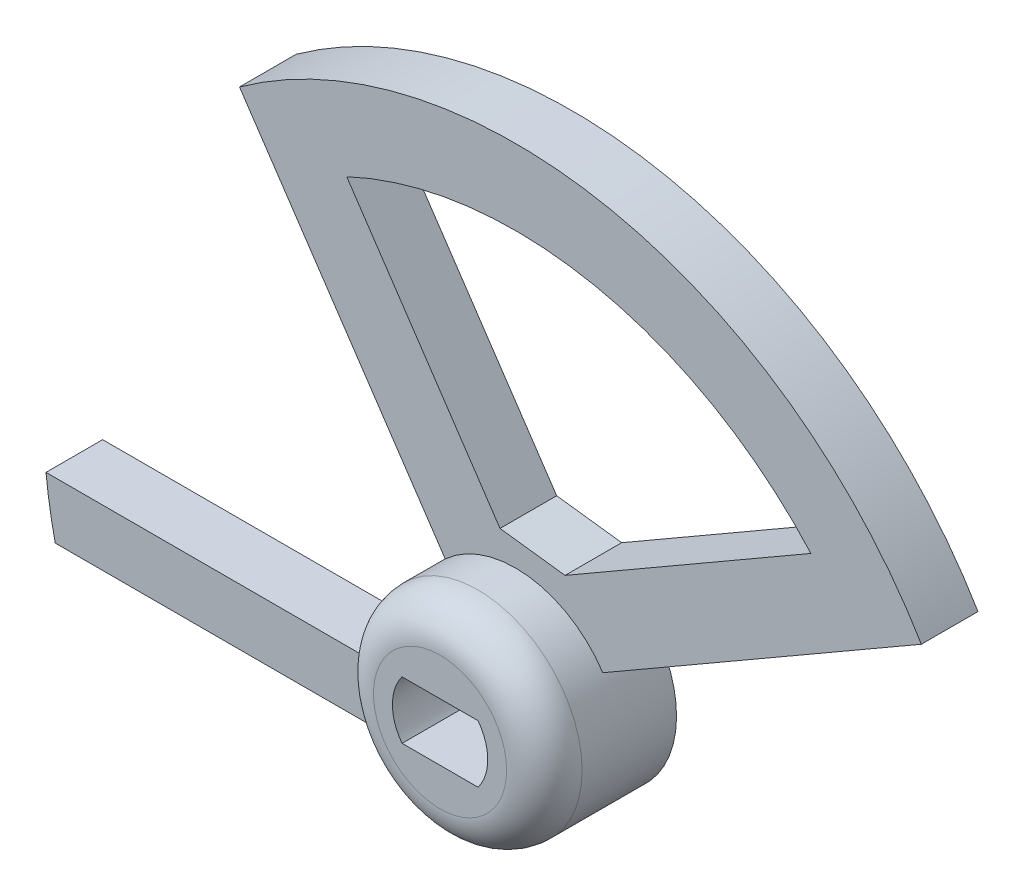
from build123d import *
from build123d.topology import SkipClean

# Parameters (mm, degrees)
BOSS_EXTRUDE2_DEPTH = 3
CUT_EXTRUDE1_DEPTH  = 3
BOSS_EXTRUDE3_DEPTH = 4
FILLET1_R           = 2


with BuildPart() as part:
    # Sketch1 → Boss-Extrude2 (new body)
    with BuildSketch(Plane.XY):
        with BuildLine():
            ThreePointArc((0, -5.525), (-2.878801834, -4.715731651), (-4.91426495, -2.525))
            Line((-4.91426495, -2.525), (-24.872160642, -2.525))
            ThreePointArc((-24.872160642, -2.525), (-24.672642191, -4.032459214), (-24.381845193, -5.525))
            Line((-24.381845193, -5.525), (0, -5.525))
        make_face()
        with BuildLine():
            ThreePointArc((0, -2.525), (1.123610253, -2.261222015), (2.01246118, -1.525))
            Line((2.01246118, -1.525), (-2.01246118, -1.525))
            ThreePointArc((-2.01246118, -1.525), (-1.123610253, -2.261222015), (0, -2.525))
        make_face()
        with BuildLine():
            ThreePointArc((2.01246118, 1.525), (0, 2.525), (-2.01246118, 1.525))
            Line((-2.01246118, 1.525), (2.01246118, 1.525))
        make_face()
        with BuildLine():
            Line((-3.728656931, 4.077099765), (-2.01246118, 1.525))
            ThreePointArc((-2.01246118, 1.525), (0, 2.525), (2.01246118, 1.525))
            Line((2.01246118, 1.525), (4.61980513, 3.030350732))
            ThreePointArc((4.61980513, 3.030350732), (0.687355194, 5.482076964), (-3.728656931, 4.077099765))
        make_face()
        with BuildLine():
            ThreePointArc((0, -2.525), (-1.123610253, -2.261222015), (-2.01246118, -1.525))
            ThreePointArc((-2.01246118, -1.525), (-2.525, 0), (-2.01246118, 1.525))
            Line((-2.01246118, 1.525), (-3.728656931, 4.077099765))
            ThreePointArc((-3.728656931, 4.077099765), (-5.438010205, 0.976560297), (-4.91426495, -2.525))
            Line((-4.91426495, -2.525), (0, -2.525))
        make_face()
        with BuildLine():
            Line((0, -5.525), (0, -2.525))
            Line((0, -2.525), (-4.91426495, -2.525))
            ThreePointArc((-4.91426495, -2.525), (-2.878801834, -4.715731651), (0, -5.525))
        make_face()
        with BuildLine():
            ThreePointArc((2.525, 0), (2.39343785, -0.804412991), (2.01246118, -1.525))
            ThreePointArc((2.01246118, -1.525), (1.123610253, -2.261222015), (0, -2.525))
            Line((0, -2.525), (0, -5.525))
            ThreePointArc((0, -5.525), (3.906764966, -3.906764966), (5.525, 0))
            Line((5.525, 0), (2.525, 0))
        make_face()
        with BuildLine():
            ThreePointArc((2.01246118, 1.525), (2.39343785, 0.804412991), (2.525, 0))
            Line((2.525, 0), (5.525, 0))
            ThreePointArc((5.525, 0), (5.293866656, 1.581328817), (4.61980513, 3.030350732))
            Line((4.61980513, 3.030350732), (2.01246118, 1.525))
        make_face()
        with BuildLine():
            Line((-14.622794466, 20.277422963), (-3.728656931, 4.077099765))
            ThreePointArc((-3.728656931, 4.077099765), (0.687355194, 5.482076964), (4.61980513, 3.030350732))
            Line((4.61980513, 3.030350732), (21.491693232, 12.771339869))
            ThreePointArc((21.491693232, 12.771339869), (5.087313969, 24.476912317), (-14.622794466, 20.277422963))
        make_face()
    extrude(amount=BOSS_EXTRUDE2_DEPTH)

    # Sketch2 → Cut-Extrude1 (cut)
    with BuildSketch(Plane.XY.offset(3)):
        with BuildLine():
            Line((-8.943662301, 19.000286962), (-0.824328522, 6.926285605))
            Line((-0.824328522, 6.926285605), (2.61980513, 6.494452347))
            Line((2.61980513, 6.494452347), (15.641340759, 14.012439447))
            ThreePointArc((15.641340759, 14.012439447), (4.175449663, 20.580709903), (-8.943662301, 19.000286962))
        make_face()
    extrude(amount=-CUT_EXTRUDE1_DEPTH, mode=Mode.SUBTRACT)

    # Sketch3 → Boss-Extrude3 (add)
    with SkipClean():  # the faces are left unmerged after this step: merging them gives an invalid solid
        with BuildSketch(Plane.XY.offset(3)):
            with BuildLine():
                ThreePointArc((5.525, 0), (5.293866656, 1.581328817), (4.61980513, 3.030350732))
                ThreePointArc((4.61980513, 3.030350732), (0.687355194, 5.482076964), (-3.728656931, 4.077099765))
                ThreePointArc((-3.728656931, 4.077099765), (-5.438010205, 0.976560297), (-4.91426495, -2.525))
                ThreePointArc((-4.91426495, -2.525), (-2.878801834, -4.715731651), (0, -5.525))
                ThreePointArc((0, -5.525), (3.906764966, -3.906764966), (5.525, 0))
            make_face()
            with BuildLine():
                Line((-2.01246118, 1.525), (2.01246118, 1.525))
                ThreePointArc((2.01246118, 1.525), (2.525, 0), (2.01246118, -1.525))
                Line((2.01246118, -1.525), (-2.01246118, -1.525))
                ThreePointArc((-2.01246118, -1.525), (-2.525, 0), (-2.01246118, 1.525))
            make_face(mode=Mode.SUBTRACT)
        extrude(amount=BOSS_EXTRUDE3_DEPTH)

    # Fillet1
    fillet1_edges = [part.edges().sort_by_distance(p)[0] for p in [
        (3.728656931, -4.077099765, 7),
    ]]
    fillet(fillet1_edges, radius=FILLET1_R)


solid = part.part
